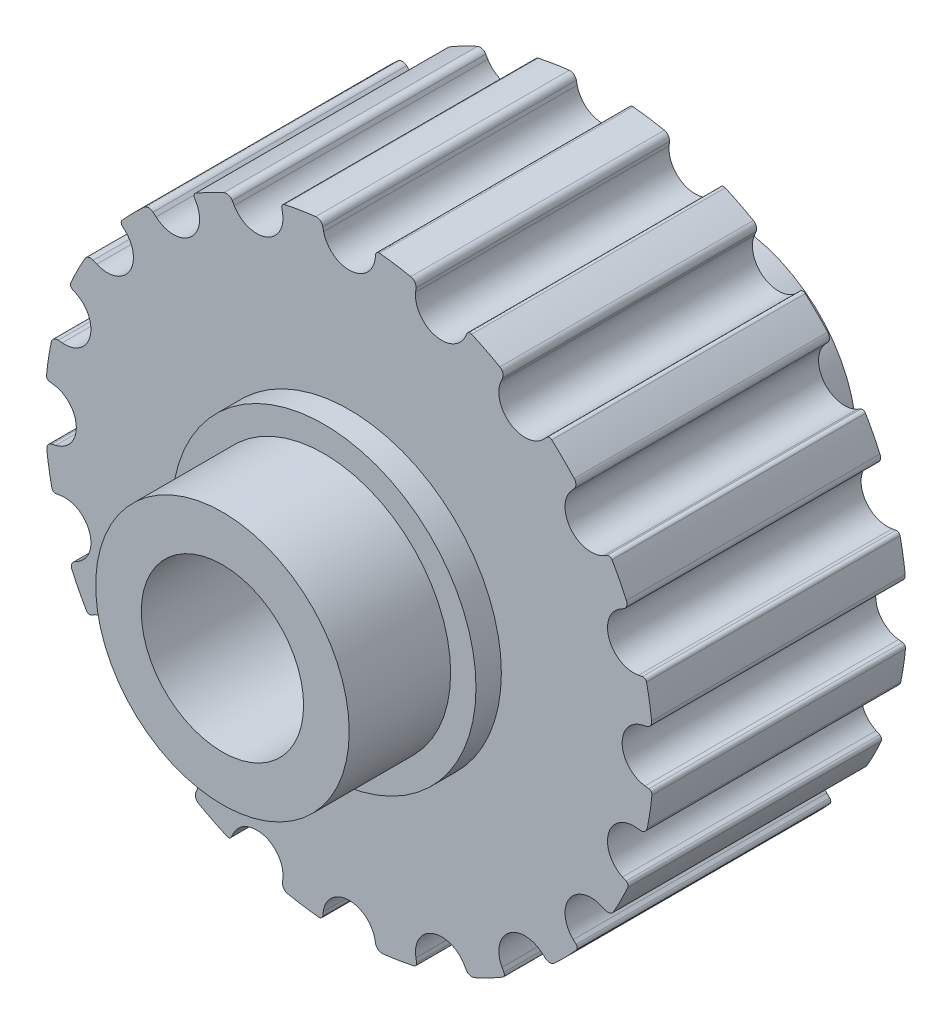
from build123d import *

# Parameters (mm, degrees)
SKETCH_1_R               = 6
SKETCH_1_R_2             = 2.5
EXTRUDE_1_DEPTH          = 5
CUT_EXTRUDE_START        = -5
CUT_EXTRUDE_1_DEPTH      = 5
PATTERN_CIRCULAR_1_COUNT = 20
EXTRUDE_START            = -5.5
SKETCH_3_R               = 3
SKETCH_3_R_2             = 2.5
EXTRUDE_2_DEPTH          = 6
SKETCH_4_R               = 2.5
SKETCH_4_R_2             = 1.6
EXTRUDE_3_DEPTH          = 2
SKETCH_5_R               = 2.5
SKETCH_5_R_2             = 1.6
EXTRUDE_4_DEPTH          = 8


with BuildPart() as part:
    # 草图1 → 凸台-拉伸1 (new body)
    with BuildSketch(Plane.XY):
        Circle(SKETCH_1_R)
        Circle(SKETCH_1_R_2, mode=Mode.SUBTRACT)
    extrude(amount=EXTRUDE_1_DEPTH)

    # 草图2 → 切除-拉伸1 (cut)
    with BuildSketch(Plane.XY.offset(5).offset(CUT_EXTRUDE_START)):
        with BuildLine():
            Line((0.511862463, 5.832363511), (0.521654336, 5.909021561))
            ThreePointArc((0.521654336, 5.909021561), (0.547634704, 5.955147301), (0.598423406, 5.970082866))
            ThreePointArc((0.598423406, 5.970082866), (-0.031806753, 5.999915694), (-0.661685201, 5.963402778))
            ThreePointArc((-0.661685201, 5.963402778), (-0.571930624, 5.939984659), (-0.520777334, 5.862604859))
            Line((-0.520777334, 5.862604859), (-0.50376482, 5.785946809))
            ThreePointArc((-0.50376482, 5.785946809), (0.023558873, 5.382262679), (0.511862463, 5.832363511))
        make_face()
    cut_extrude_1 = extrude(amount=CUT_EXTRUDE_1_DEPTH, mode=Mode.SUBTRACT)

    # 阵列(圆周)1: 切除-拉伸1 ×20 about axis
    pattern_circular_1_axis = Axis((0, 0, 0), (0, 0, 1))
    for i in range(1, PATTERN_CIRCULAR_1_COUNT):
        add(cut_extrude_1.rotate(pattern_circular_1_axis, i * 360 / PATTERN_CIRCULAR_1_COUNT), mode=Mode.SUBTRACT)

    # 草图3 → 凸台-拉伸2 (add)
    with BuildSketch(Plane.XY.offset(5).offset(EXTRUDE_START)):
        Circle(SKETCH_3_R)
        Circle(SKETCH_3_R_2, mode=Mode.SUBTRACT)
    extrude(amount=EXTRUDE_2_DEPTH)



with BuildPart() as body_2:
    # 草图4 → 凸台-拉伸3 (new body)
    with BuildSketch(Plane(origin=(0, 0, -0.5), x_dir=(-1, 0, 0), z_dir=(0, 0, -1))):
        with Locations(Location((0, 0, 0), (0, 0, 180))):
            Circle(SKETCH_4_R)
        Circle(SKETCH_4_R_2, mode=Mode.SUBTRACT)
    extrude(amount=EXTRUDE_3_DEPTH)


with BuildPart() as part_1:
    add(part.part)

    add(body_2.part)  # 凸台-拉伸4 merges body 2
    # 草图5 → 凸台-拉伸4 (add)
    with BuildSketch(Plane.XY.offset(-0.5)):
        Circle(SKETCH_5_R)
        with Locations(Location((0, 0, 0), (0, 0, 180))):
            Circle(SKETCH_5_R_2, mode=Mode.SUBTRACT)
    extrude(amount=EXTRUDE_4_DEPTH)


solid = part_1.part
